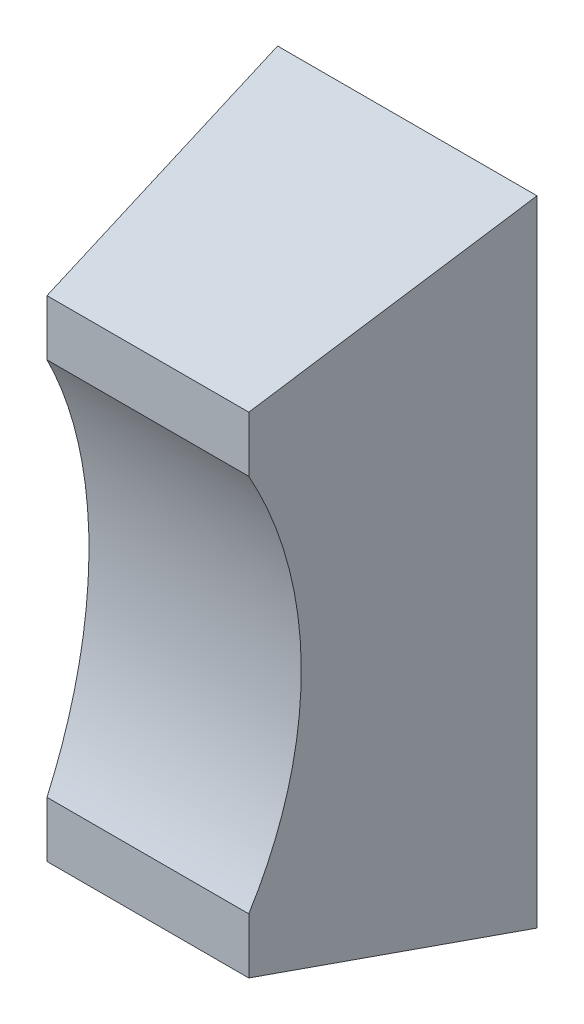
from build123d import *

# Parameters (mm, degrees)
SKETCH3_W          = 1.3
SKETCH3_H          = 4.4
CUT_EXTRUDE1_DEPTH = 5
CUT_EXTRUDE2_DEPTH = 10


with BuildPart() as part:
    # Sketch2 → Loft1 section 0
    with BuildSketch(Plane.XY.offset(9)):
        with BuildLine():
            Line((-3.5, 8.5), (3.5, 8.5))
            Line((3.5, 8.5), (3.5, -8.5))
            Line((3.5, -8.5), (-3.5, -8.5))
            Line((-3.5, -8.5), (-3.5, 8.5))
        make_face()
    # Sketch1 → Loft1 section 1
    with BuildSketch(Plane.XY):
        with BuildLine():
            Line((-4.5, 11), (4.5, 11))
            Line((4.5, 11), (4.5, -11))
            Line((4.5, -11), (-4.5, -11))
            Line((-4.5, -11), (-4.5, 11))
        make_face()
    loft()

    # Sketch3 → Cut-Extrude1 (cut)
    with BuildSketch(Plane(origin=(0, 0, 0), x_dir=(-1, 0, 0), z_dir=(0, 0, -1))):
        Rectangle(SKETCH3_W, SKETCH3_H)
    extrude(amount=-CUT_EXTRUDE1_DEPTH, mode=Mode.SUBTRACT)

    # Sketch4 → Cut-Extrude2 (cut, symmetric)
    with BuildSketch(Plane(origin=(0, 0, 0), x_dir=(0, 0, -1), z_dir=(1, 0, 0))):
        with BuildLine():
            Line((-9.861070231, 7.982564486), (-10.140578955, -8.37058785))
            ThreePointArc((-10.140578955, -8.37058785), (-7.362485205, -0.239106283), (-9.861070231, 7.982564486))
        make_face()
    extrude(amount=CUT_EXTRUDE2_DEPTH, both=True, mode=Mode.SUBTRACT)


solid = part.part
